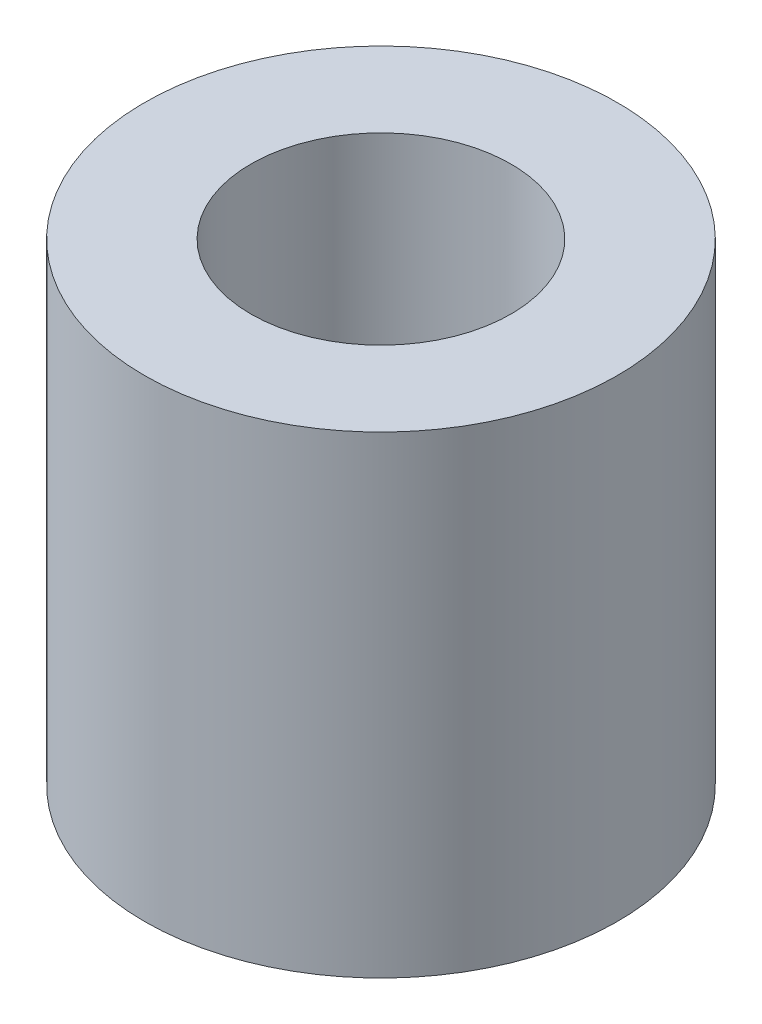
from build123d import *

# Parameters (mm, degrees)
CROQUIS2_R                       = 2
SALIENTE_EXTRUIR1_DEPTH          = 4
TALADRO_DE_MARGEN_PARA_M21_D     = 2.2
TALADRO_DE_MARGEN_PARA_M21_DEPTH = 20
TALADRO_DE_MARGEN_PARA_M21_TIP   = 0.660946681


with BuildPart() as part:
    # Croquis2 → Saliente-Extruir1 (new body)
    with BuildSketch(Plane(origin=(0, 0, 0), x_dir=(1, 0, 0), z_dir=(0, 1, 0))):
        with Locations(Location((0, 0, 0), (0, 0, 270))):
            Circle(CROQUIS2_R)
    extrude(amount=SALIENTE_EXTRUIR1_DEPTH)

    # Taladro de margen para M21
    with Locations(Plane(origin=(0, 4, 0), x_dir=(1, 0, 0), z_dir=(0, 1, 0))):
        with Locations((0, 0)):
            Hole(TALADRO_DE_MARGEN_PARA_M21_D / 2, depth=TALADRO_DE_MARGEN_PARA_M21_DEPTH)
            with Locations((0, 0, -(TALADRO_DE_MARGEN_PARA_M21_DEPTH + TALADRO_DE_MARGEN_PARA_M21_TIP / 2))):  # 118° drill point
                Cone(0, TALADRO_DE_MARGEN_PARA_M21_D / 2, TALADRO_DE_MARGEN_PARA_M21_TIP, mode=Mode.SUBTRACT)


solid = part.part
